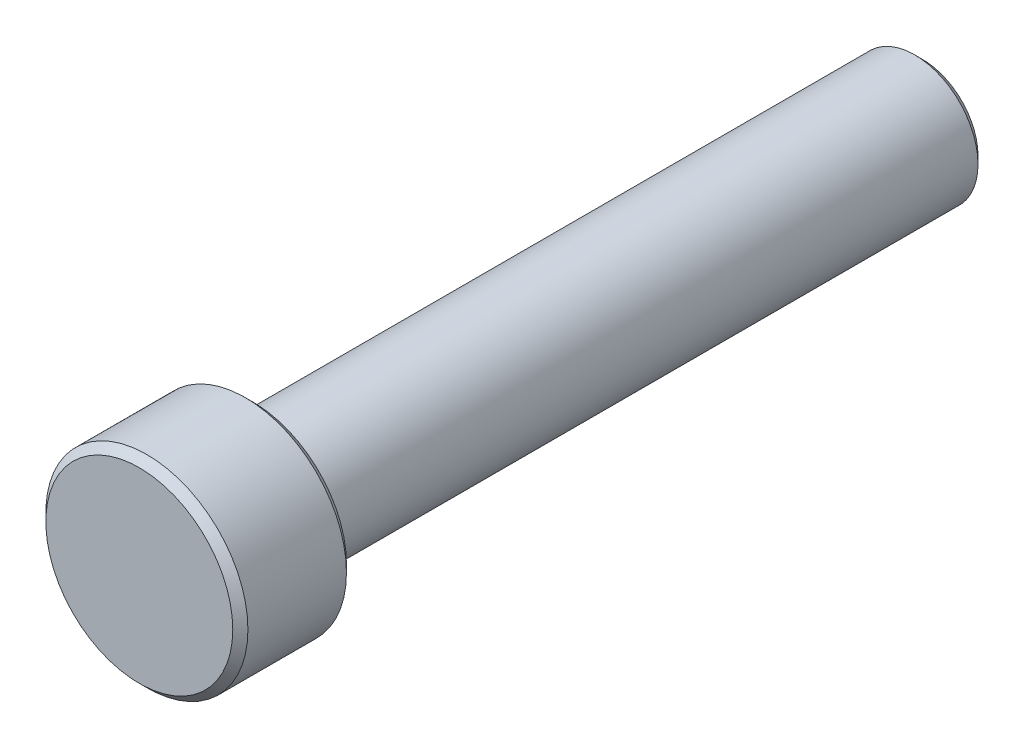
from build123d import *

# Parameters (mm, degrees)
SKETCH1_R           = 2.5
BOSS_EXTRUDE1_DEPTH = 26.5
SKETCH2_R           = 4
BOSS_EXTRUDE2_DEPTH = 4.5
CHAMFER1_SIZE       = 0.3


with BuildPart() as part:
    # Sketch1 → Boss-Extrude1 (new body)
    with BuildSketch(Plane.XY):
        Circle(SKETCH1_R)
    extrude(amount=BOSS_EXTRUDE1_DEPTH)

    # Sketch2 → Boss-Extrude2 (add)
    with BuildSketch(Plane.XY.offset(26.5)):
        Circle(SKETCH2_R)
    extrude(amount=BOSS_EXTRUDE2_DEPTH)

    # Chamfer1
    chamfer1_edges = [part.edges().sort_by_distance(p)[0] for p in [
        (-2.5, 0, 0),
        (-4, 0, 26.5),
        (-4, 0, 31),
    ]]
    chamfer(chamfer1_edges, length=CHAMFER1_SIZE)


solid = part.part
